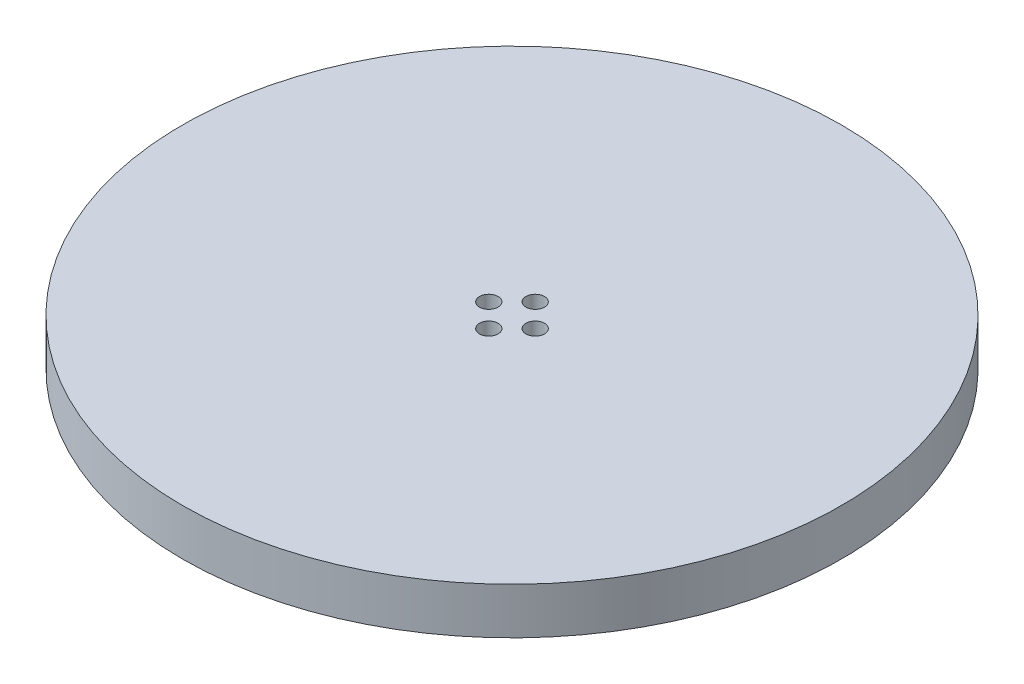
from build123d import *

# Parameters (mm, degrees)
SKETCH_6_R      = 71
SKETCH_6_R_2    = 2
EXTRUDE_2_DEPTH = 10


with BuildPart() as part:
    # 草圖6 → 填料-伸長2 (new body)
    with BuildSketch(Plane(origin=(0, 0, 0), x_dir=(1, 0, 0), z_dir=(0, 1, 0))):
        Circle(SKETCH_6_R)
        with Locations((0, -5)):
            Circle(SKETCH_6_R_2, mode=Mode.SUBTRACT)
        with Locations((-5, 0)):
            Circle(SKETCH_6_R_2, mode=Mode.SUBTRACT)
        with Locations((5, 0)):
            Circle(SKETCH_6_R_2, mode=Mode.SUBTRACT)
        with Locations((0, 5)):
            Circle(SKETCH_6_R_2, mode=Mode.SUBTRACT)
    extrude(amount=EXTRUDE_2_DEPTH)


solid = part.part
